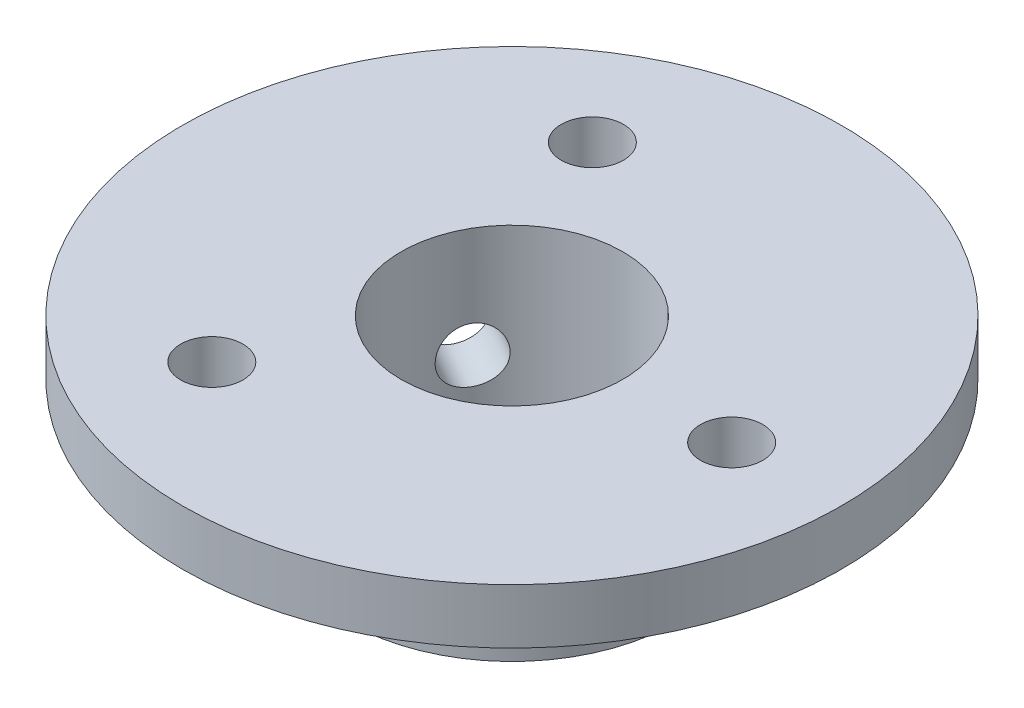
from build123d import *

# Parameters (mm, degrees)
HUB_NECK_SKETCH_R                   = 9
HUB_NECK_DEPTH                      = 10
RIM_CLAMP_FLANGE_SKETCH_R           = 18
RIM_CLAMP_FLANGE_DEPTH              = 3
AXLE_CLEARANCE_SKETCH_R             = 6.05
AXLE_CLEARANCE_DEPTH                = 10.2
RIM_BOLT_CLEARANCE_PATTERN_SKETCH_R = 1.7
RIM_BOLT_CLEARANCE_PATTERN_DEPTH    = 3.2
POSITIVE_HUB_PIN_BORE_SKETCH_R      = 1.5
POSITIVE_HUB_PIN_BORE_DEPTH         = 20


with BuildPart() as part:
    # Hub neck sketch → Hub neck (new body)
    with BuildSketch(Plane(origin=(0, -273, 0), x_dir=(1, 0, 0), z_dir=(0, 1, 0))):
        with Locations(Location((-19.009182883, 53.244882879, 0), (0, 0, 270))):
            Circle(HUB_NECK_SKETCH_R)
    extrude(amount=HUB_NECK_DEPTH)

    # Rim clamp flange sketch → Rim clamp flange (add)
    with BuildSketch(Plane(origin=(0, -266, 0), x_dir=(1, 0, 0), z_dir=(0, 1, 0))):
        with Locations(Location((-19.009182883, 53.244882879, 0), (0, 0, 270))):
            Circle(RIM_CLAMP_FLANGE_SKETCH_R)
    extrude(amount=RIM_CLAMP_FLANGE_DEPTH)

    # Axle clearance sketch → Axle clearance (cut)
    with BuildSketch(Plane(origin=(0, -273.1, 0), x_dir=(1, 0, 0), z_dir=(0, 1, 0))):
        with Locations(Location((-19.009182883, 53.244882879, 0), (0, 0, 270))):
            Circle(AXLE_CLEARANCE_SKETCH_R)
    extrude(amount=AXLE_CLEARANCE_DEPTH, mode=Mode.SUBTRACT)

    # Rim bolt clearance pattern sketch → Rim bolt clearance pattern (cut)
    with BuildSketch(Plane(origin=(0, -266.1, 0), x_dir=(1, 0, 0), z_dir=(0, 1, 0))):
        with Locations(Location((-7.009182883, 53.244882879, 0), (0, 0, 270))):
            Circle(RIM_BOLT_CLEARANCE_PATTERN_SKETCH_R)
        with Locations(Location((-25.009182883, 42.852578033, 0), (0, 0, 270))):
            Circle(RIM_BOLT_CLEARANCE_PATTERN_SKETCH_R)
        with Locations(Location((-25.009182883, 63.637187724, 0), (0, 0, 270))):
            Circle(RIM_BOLT_CLEARANCE_PATTERN_SKETCH_R)
    extrude(amount=RIM_BOLT_CLEARANCE_PATTERN_DEPTH, mode=Mode.SUBTRACT)

    # Positive hub pin bore sketch → Positive hub pin bore (cut)
    with BuildSketch(Plane(origin=(-45.972851797, 0, -26.542438361), x_dir=(0.5000000000000001, 0, -0.8660254037844386), z_dir=(0.8660254037844386, 0, 0.5000000000000001))):
        with Locations(Location((36.606829753, -269, 0), (0, 0, 180))):
            Circle(POSITIVE_HUB_PIN_BORE_SKETCH_R)
    extrude(amount=POSITIVE_HUB_PIN_BORE_DEPTH, mode=Mode.SUBTRACT)


solid = part.part
